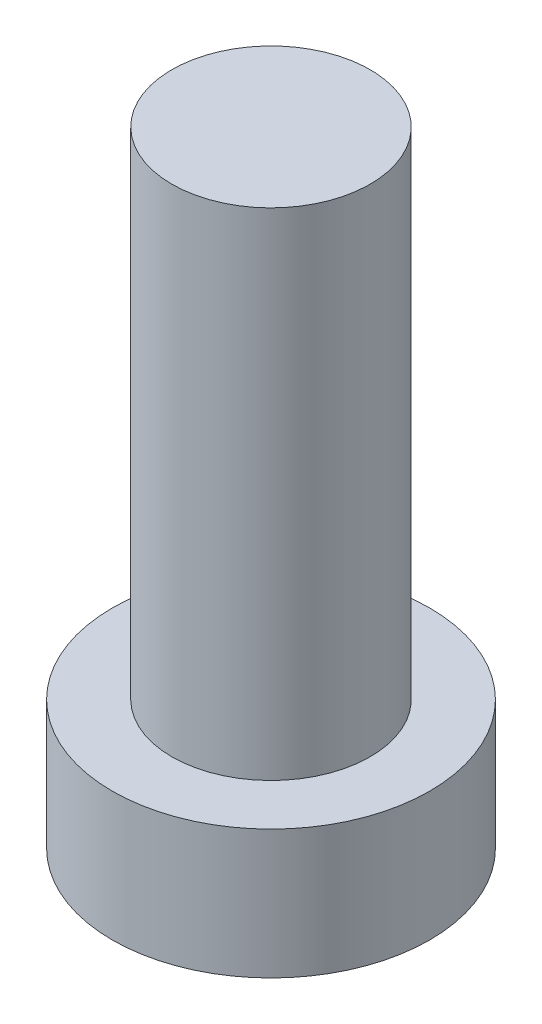
from build123d import *

# Parameters (mm, degrees)
SKETCH_1_R      = 1.6
EXTRUDE_1_DEPTH = 1.3
EXTRUDE_START   = 1.3
SKETCH_2_R      = 1
EXTRUDE_2_DEPTH = 5


with BuildPart() as part:
    # 草图1 → 凸台-拉伸1 (new body)
    with BuildSketch(Plane(origin=(0, 0, 0), x_dir=(1, 0, 0), z_dir=(0, 1, 0))):
        with Locations(Location((0, 0, 0), (0, 0, 270))):
            Circle(SKETCH_1_R)
    extrude(amount=EXTRUDE_1_DEPTH)

    # 草图2 → 凸台-拉伸2 (add)
    with BuildSketch(Plane(origin=(0, 0, 0), x_dir=(1, 0, 0), z_dir=(0, 1, 0)).offset(EXTRUDE_START)):
        with Locations(Location((0, 0, 0), (0, 0, 270))):
            Circle(SKETCH_2_R)
    extrude(amount=EXTRUDE_2_DEPTH)


solid = part.part
